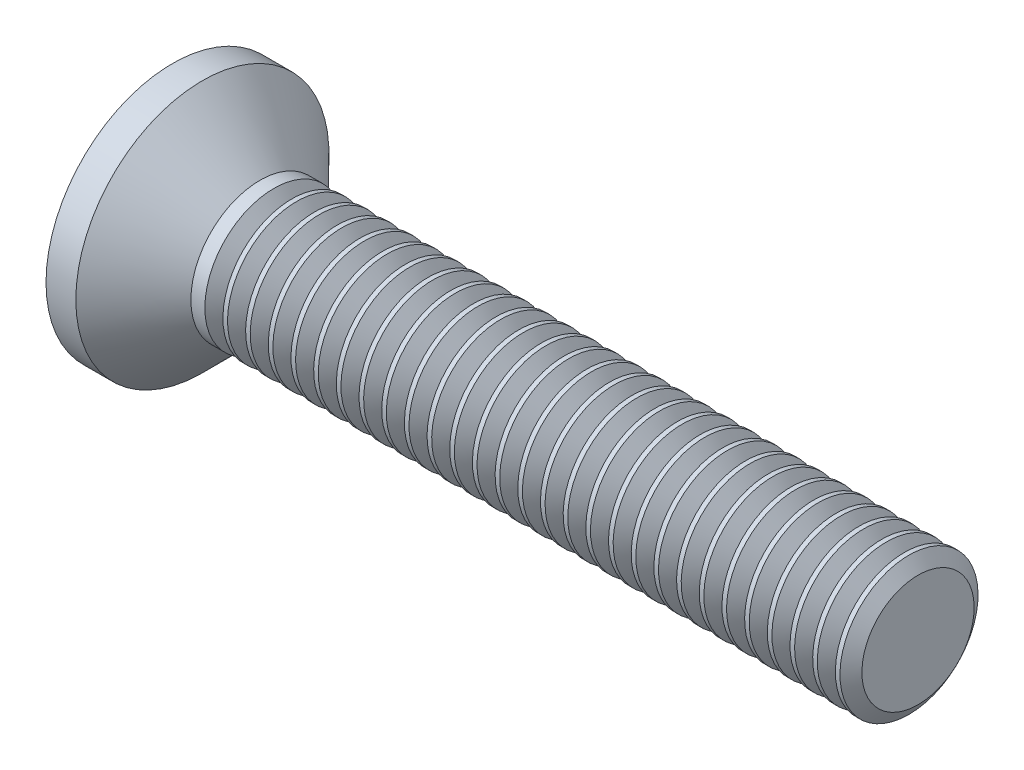
from build123d import *

# Parameters (mm, degrees)
CIRPATTERN1_COUNT = 2
CIRPATTERN1_ANGLE = 90
THDSCHPAT_COUNT   = 29
THDSCHPAT_PITCH   = 0.492857143


with BuildPart() as part:
    # BodySke → Base-Revolve (revolve)
    with BuildSketch(Plane.XY, mode=Mode.PRIVATE) as base_revolve_sk:
        with BuildLine():
            Line((0, 0), (16.727669073, 0))
            Line((16.727669073, 0), (16.727669073, 1.5))
            Line((16.727669073, 1.5), (2.427669073, 1.5))
            Line((2.427669073, 1.5), (1.177669073, 2.75))
            Line((1.177669073, 2.75), (0.529956332, 2.75))
            ThreePointArc((0.529956332, 2.75), (0.133696843, 1.400299407), (0, 0))
        make_face()
    revolve(base_revolve_sk.sketch.rotate(Axis((-15.875, 0, 0), (1, 0, 0)), 90), axis=Axis((-15.875, 0, 0), (1, 0, 0)))

    # Sketch3 → Cross section 0
    with BuildSketch(Plane(origin=(0, 0, 0), x_dir=(0, 0, -1), z_dir=(1, 0, 0))):
        with BuildLine():
            Line((0.415, -1.72), (-0.415, -1.72))
            Line((-0.415, -1.72), (-0.415, 1.72))
            Line((-0.415, 1.72), (0.415, 1.72))
            Line((0.415, 1.72), (0.415, -1.72))
        make_face()
    # Sketch4 → Cross section 1
    with BuildSketch(Plane(origin=(2.33, 0, 0), x_dir=(0, 0, -1), z_dir=(1, 0, 0))):
        with BuildLine():
            Line((0.2075, -0.2075), (-0.2075, -0.2075))
            Line((-0.2075, -0.2075), (-0.2075, 0.2075))
            Line((-0.2075, 0.2075), (0.2075, 0.2075))
            Line((0.2075, 0.2075), (0.2075, -0.2075))
        make_face()
    cross = loft(mode=Mode.SUBTRACT)

    # CirPattern1: Cross ×2 about axis
    cirpattern1_axis = Axis((0, 0, 0), (1, 0, 0))
    for i in range(1, CIRPATTERN1_COUNT):
        add(cross.rotate(cirpattern1_axis, i * CIRPATTERN1_ANGLE / (CIRPATTERN1_COUNT - 1)), mode=Mode.SUBTRACT)

    # ThdSchSke → ThreadSchematic (revolve, cut)
    with BuildSketch(Plane.XY):
        Polygon((2.927669073, -1.2195), (2.731260858, -1.5), (2.731260858, -1.875), (3.124077287, -1.875), (3.124077287, -1.5), align=None)
    threadschematic = revolve(axis=Axis((-3.175, 0, 0), (1, 0, 0)), mode=Mode.SUBTRACT)

    # ThdSchPat: ThreadSchematic ×29
    with Locations(*[(i * THDSCHPAT_PITCH, 0, 0) for i in range(1, THDSCHPAT_COUNT)]):
        add(threadschematic, mode=Mode.SUBTRACT)


solid = part.part
